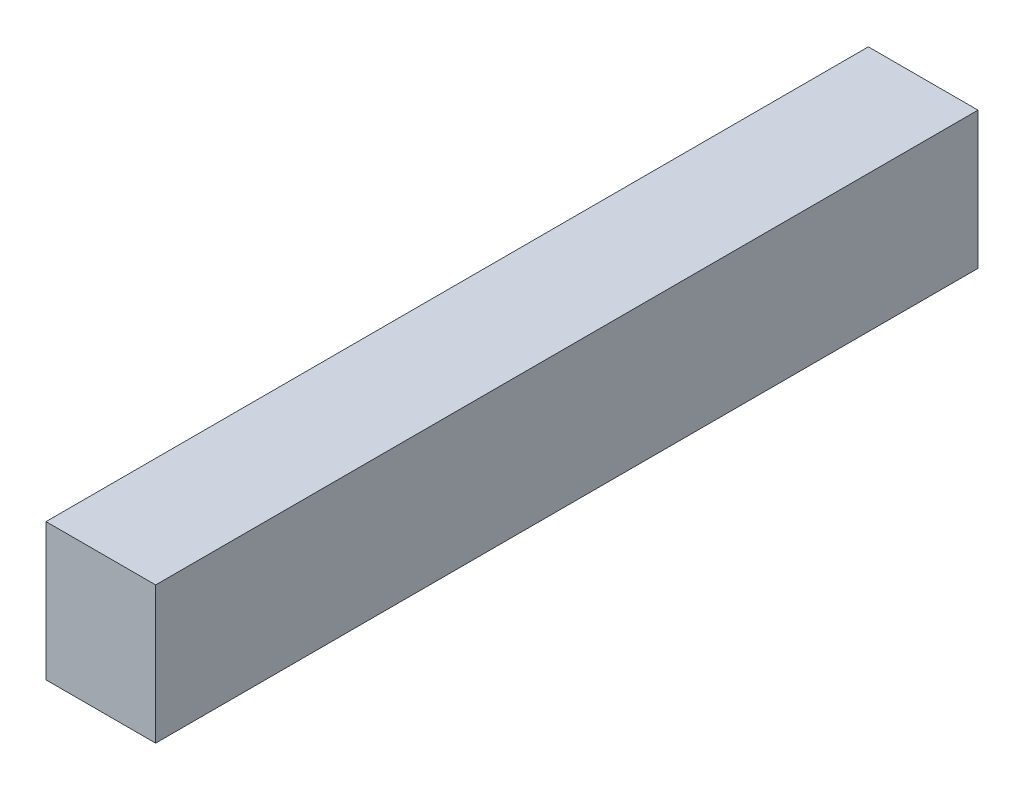
from build123d import *

# Parameters (mm, degrees)
ESBO_O1_W                = 4
ESBO_O1_H                = 5
RESSALTO_EXTRUS_O1_DEPTH = 30


with BuildPart() as part:
    # Esboço1 → Ressalto-extrusão1 (new body)
    with BuildSketch(Plane.XY):
        with Locations((2, 2.5)):
            Rectangle(ESBO_O1_W, ESBO_O1_H)
    extrude(amount=RESSALTO_EXTRUS_O1_DEPTH)


solid = part.part
